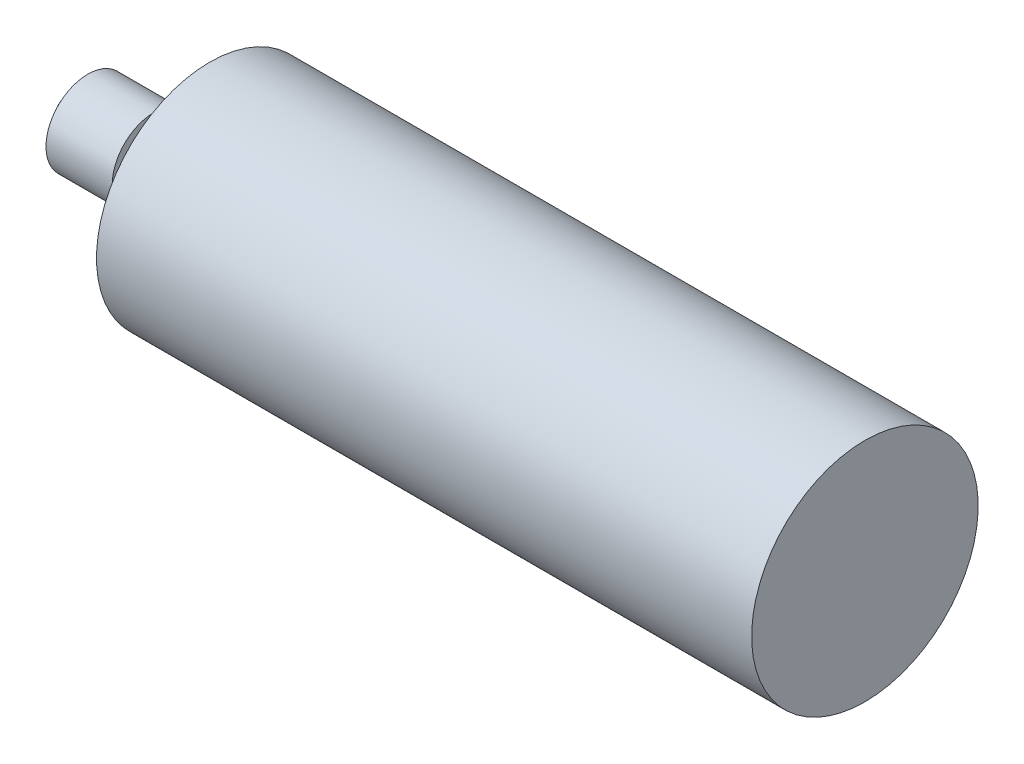
from build123d import *

# Parameters (mm, degrees)
SKETCH_2_R      = 5
EXTRUDE_2_DEPTH = 5


with BuildPart() as part:
    # 草图1 → 旋转1 (revolve)
    with BuildSketch(Plane.XY):
        Polygon((0, 0), (0, 12), (19, 12), (19, 9), (33, 9), (33, 24), (35, 24), (35, 32.5), (223, 32.5), (223, 0), align=None)
    revolve(axis=Axis((223, 0, 0), (-1, 0, 0)))

    # 草图2 → 凸台-拉伸2 (add)
    with BuildSketch(Plane.ZY):
        with Locations(Location((0, 0, 0), (0, 0, 270))):
            Circle(SKETCH_2_R)
    extrude(amount=EXTRUDE_2_DEPTH)


solid = part.part
